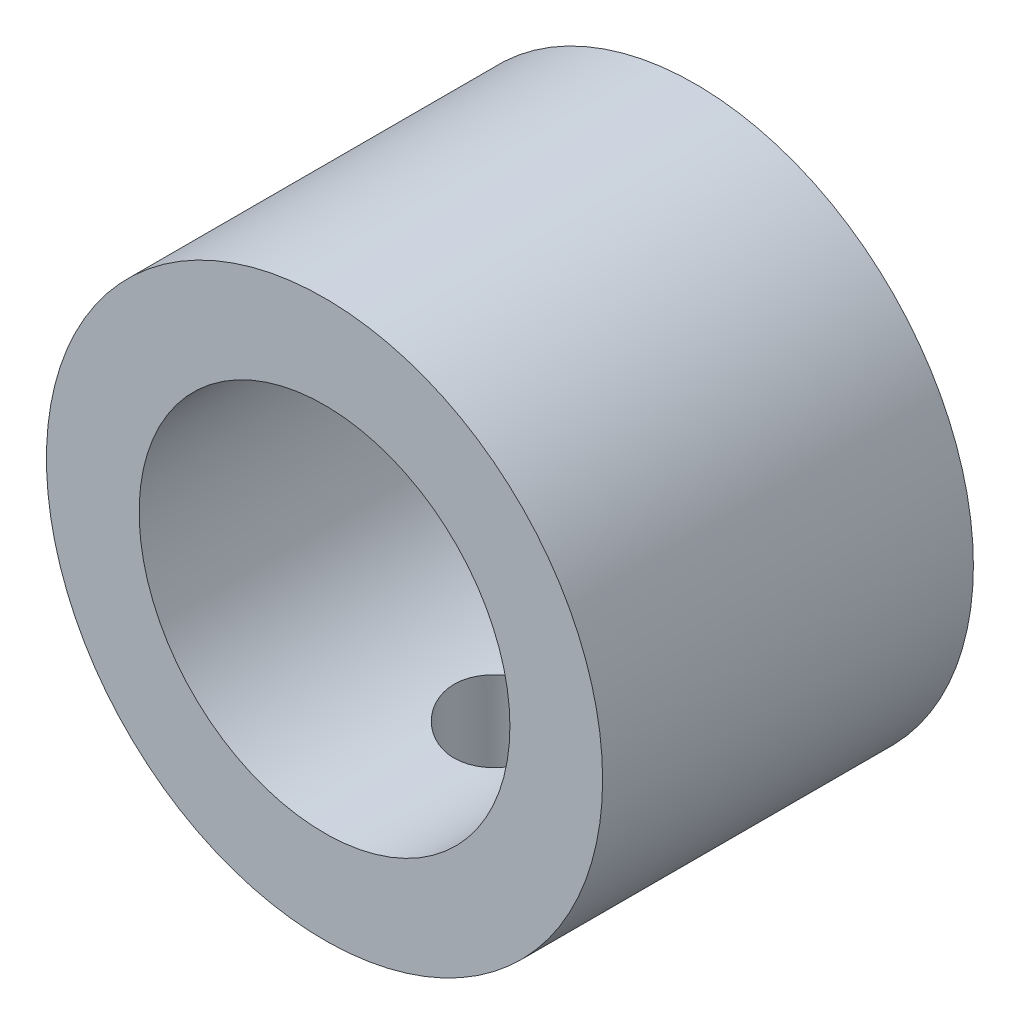
from build123d import *

# Parameters (mm, degrees)
SKETCH1_R               = 7.5
SKETCH1_R_2             = 5
BOSS_EXTRUDE3_DEPTH     = 5
CUT_EXTRUDE4_REACH      = 13.726
CUT_EXTRUDE4_END_RADIUS = 7.5
SKETCH10_R              = 1.5


with BuildPart() as part:
    # Sketch1 → Boss-Extrude3 (new, symmetric)
    with BuildSketch(Plane.XY):
        Circle(SKETCH1_R)
        Circle(SKETCH1_R_2, mode=Mode.SUBTRACT)
    extrude(amount=BOSS_EXTRUDE3_DEPTH, both=True)

    # Cut-Extrude4: up to this cylinder (the profile starts inside it)
    cut_extrude4_end = Plane(origin=(0, 0, 0), z_dir=(0, 0, -1)) * Cylinder(CUT_EXTRUDE4_END_RADIUS, 43.452, mode=Mode.PRIVATE)
    # Sketch10 → Cut-Extrude4 (cut, up to the surface)
    with BuildSketch(Plane(origin=(0, 0, 0), x_dir=(1, 0, 0), z_dir=(0, 1, 0)), mode=Mode.PRIVATE) as cut_extrude4_sk1:
        with Locations(Location((0, 0, 0), (0, 0, 270))):
            Circle(SKETCH10_R)
    cut_extrude4_tool1 = extrude(cut_extrude4_sk1.sketch, amount=-CUT_EXTRUDE4_REACH, mode=Mode.PRIVATE) & cut_extrude4_end
    add(cut_extrude4_tool1.solids().sort_by_distance((0, 0, 0))[0], mode=Mode.SUBTRACT)


solid = part.part
